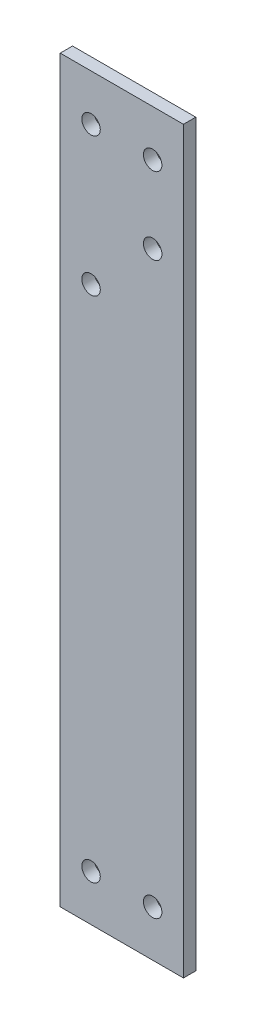
from build123d import *

# Parameters (mm, degrees)
ESQUISSE1_W                = 20
ESQUISSE1_H                = 120
EXTRUSION1_DEPTH           = 2
ESQUISSE2_R                = 1.5
EXTRUSION2_DEPTH           = 2
ESQUISSE3_R                = 1.5
EXTRUSION3_DEPTH           = 2
R_P_TITION_LIN_AIRE1_COUNT = 2
R_P_TITION_LIN_AIRE1_PITCH = 105
ESQUISSE4_R                = 1.5
ENL_V_MAT_EXTRU_1_DEPTH    = 61.860496219


with BuildPart() as part:
    # Esquisse1 → Extrusion1 (new body)
    with BuildSketch(Plane.XY):
        Rectangle(ESQUISSE1_W, ESQUISSE1_H)
    extrude(amount=EXTRUSION1_DEPTH)

    # Esquisse2 → Extrusion2 (cut)
    with BuildSketch(Plane.XY.offset(2)):
        with Locations((-5, 52.5)):
            Circle(ESQUISSE2_R)
    extrusion2 = extrude(amount=-EXTRUSION2_DEPTH, mode=Mode.SUBTRACT)

    # Esquisse3 → Extrusion3 (cut)
    with BuildSketch(Plane.XY.offset(2)):
        with Locations((5, 52.5)):
            Circle(ESQUISSE3_R)
    extrusion3 = extrude(amount=-EXTRUSION3_DEPTH, mode=Mode.SUBTRACT)

    # Répétition linéaire1: Extrusion2, Extrusion3 ×2
    with Locations(*[(0, -i * R_P_TITION_LIN_AIRE1_PITCH, 0) for i in range(1, R_P_TITION_LIN_AIRE1_COUNT)]):
        add(extrusion2, mode=Mode.SUBTRACT)
        add(extrusion3, mode=Mode.SUBTRACT)

    # Esquisse4 → Enlèv. mat.-Extru.1 (cut, through all)
    with BuildSketch(Plane(origin=(0, 0, 0), x_dir=(-1, 0, 0), z_dir=(0, 0, -1))):
        with Locations((-5, 40)):
            Circle(ESQUISSE4_R)
        with Locations((5, 30)):
            Circle(ESQUISSE4_R)
    extrude(amount=-ENL_V_MAT_EXTRU_1_DEPTH, mode=Mode.SUBTRACT)


solid = part.part
